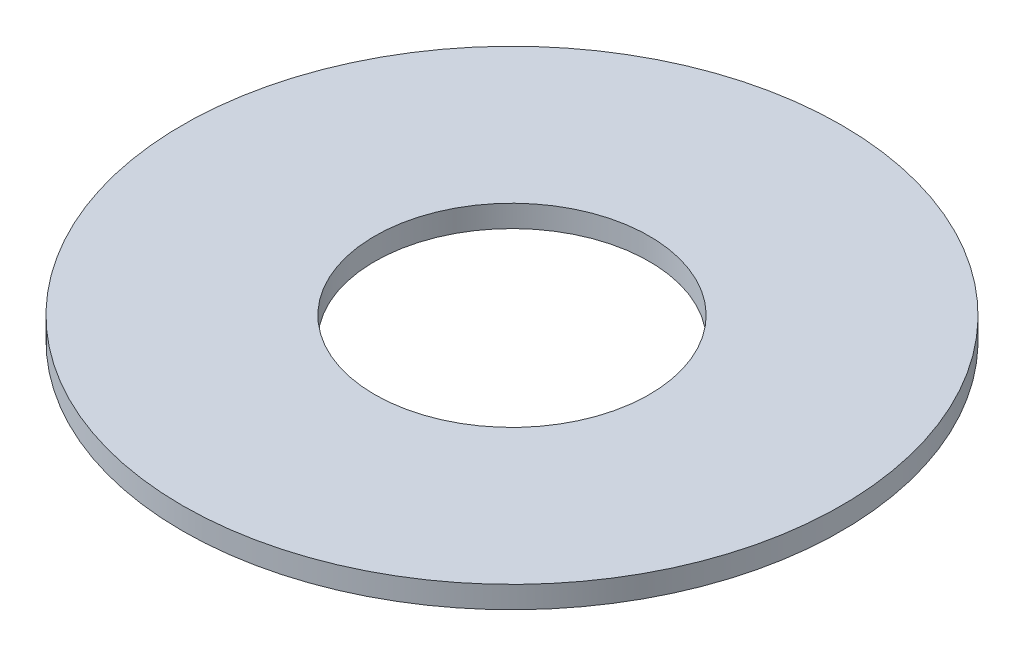
from build123d import *

# Parameters (mm, degrees)
SKETCH_1_R      = 15
SKETCH_1_R_2    = 6.25
EXTRUDE_1_DEPTH = 1


with BuildPart() as part:
    # 草图1 → 凸台-拉伸1 (new body)
    with BuildSketch(Plane(origin=(0, 0, 0), x_dir=(1, 0, 0), z_dir=(0, 1, 0))):
        with Locations(Location((0, 0, 0), (0, 0, 270))):
            Circle(SKETCH_1_R)
        with Locations(Location((0, 0, 0), (0, 0, 270))):
            Circle(SKETCH_1_R_2, mode=Mode.SUBTRACT)
    extrude(amount=EXTRUDE_1_DEPTH)


solid = part.part
